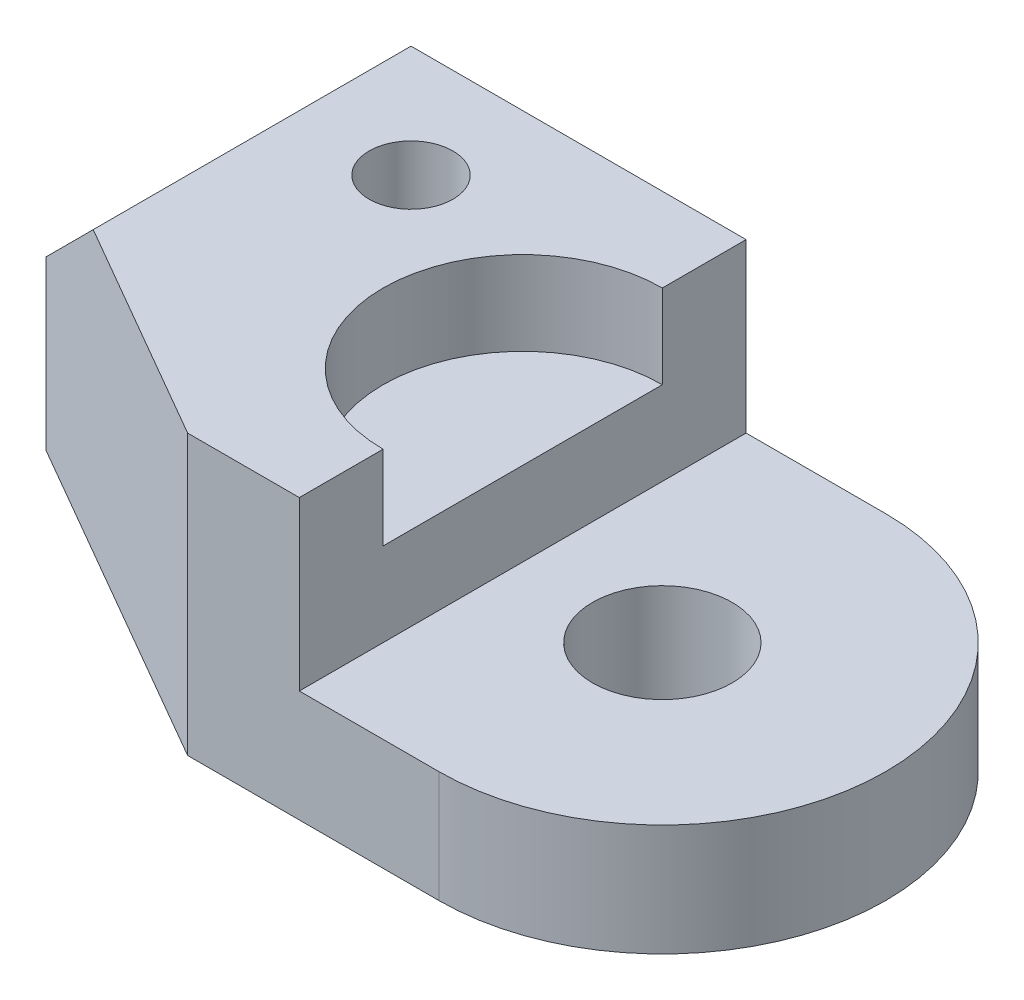
from build123d import *

# Parameters (mm, degrees)
SKETCH1_R                   = 15.875
BOSS_EXTRUDE1_DEPTH         = 25.4
BOSS_EXTRUDE2_DEPTH         = 63.5
CUT_EXTRUDE2_DEPTH          = 180.268046511
CUT_EXTRUDE3_DEPTH          = 19.05
F_3_8_0_75_DIAMETER_HOLE1_D = 19.05


with BuildPart() as part:
    # Sketch1 → Boss-Extrude1 (new body)
    with BuildSketch(Plane(origin=(0, 0, 0), x_dir=(1, 0, 0), z_dir=(0, 1, 0))):
        with BuildLine():
            Line((-31.75, 50.8), (-31.75, -50.8))
            Line((-31.75, -50.8), (0, -50.8))
            ThreePointArc((0, -50.8), (50.8, 0), (0, 50.8))
            Line((0, 50.8), (-31.75, 50.8))
        make_face()
        with Locations(Location((0, 0, 0), (0, 0, 270))):
            Circle(SKETCH1_R, mode=Mode.SUBTRACT)
    extrude(amount=BOSS_EXTRUDE1_DEPTH)

    # Sketch2 → Boss-Extrude2 (add)
    with BuildSketch(Plane(origin=(0, 0, 0), x_dir=(1, 0, 0), z_dir=(0, 1, 0))):
        Polygon((-31.75, 50.8), (-133.35, 50.8), (-133.35, -6.805909488), (-57.15, -50.8), (-31.75, -50.8), align=None)
    extrude(amount=BOSS_EXTRUDE2_DEPTH)

    # Sketch3 → Cut-Extrude2 (cut, through all)
    with BuildSketch(Plane(origin=(0, 0, -50.8), x_dir=(-1, 0, 0), z_dir=(0, 0, -1))):
        Polygon((133.35, 63.5), (133.35, 38.1), (107.95, 63.5), align=None)
    extrude(amount=-CUT_EXTRUDE2_DEPTH, mode=Mode.SUBTRACT)

    # Sketch4 → Cut-Extrude3 (cut)
    with BuildSketch(Plane(origin=(0, 63.5, 0), x_dir=(1, 0, 0), z_dir=(0, 1, 0))):
        with BuildLine():
            Line((-31.75, 31.75), (-31.75, -31.75))
            ThreePointArc((-31.75, -31.75), (-63.5, 0), (-31.75, 31.75))
        make_face()
    extrude(amount=-CUT_EXTRUDE3_DEPTH, mode=Mode.SUBTRACT)

    # 3/8 (0.75) Diameter Hole1 (through all)
    with Locations(Plane(origin=(-82.55, 63.5, -25.4), x_dir=(0, 0, 1), z_dir=(0, 1, 0))):
        with Locations((0, 0)):
            Hole(F_3_8_0_75_DIAMETER_HOLE1_D / 2)


solid = part.part
